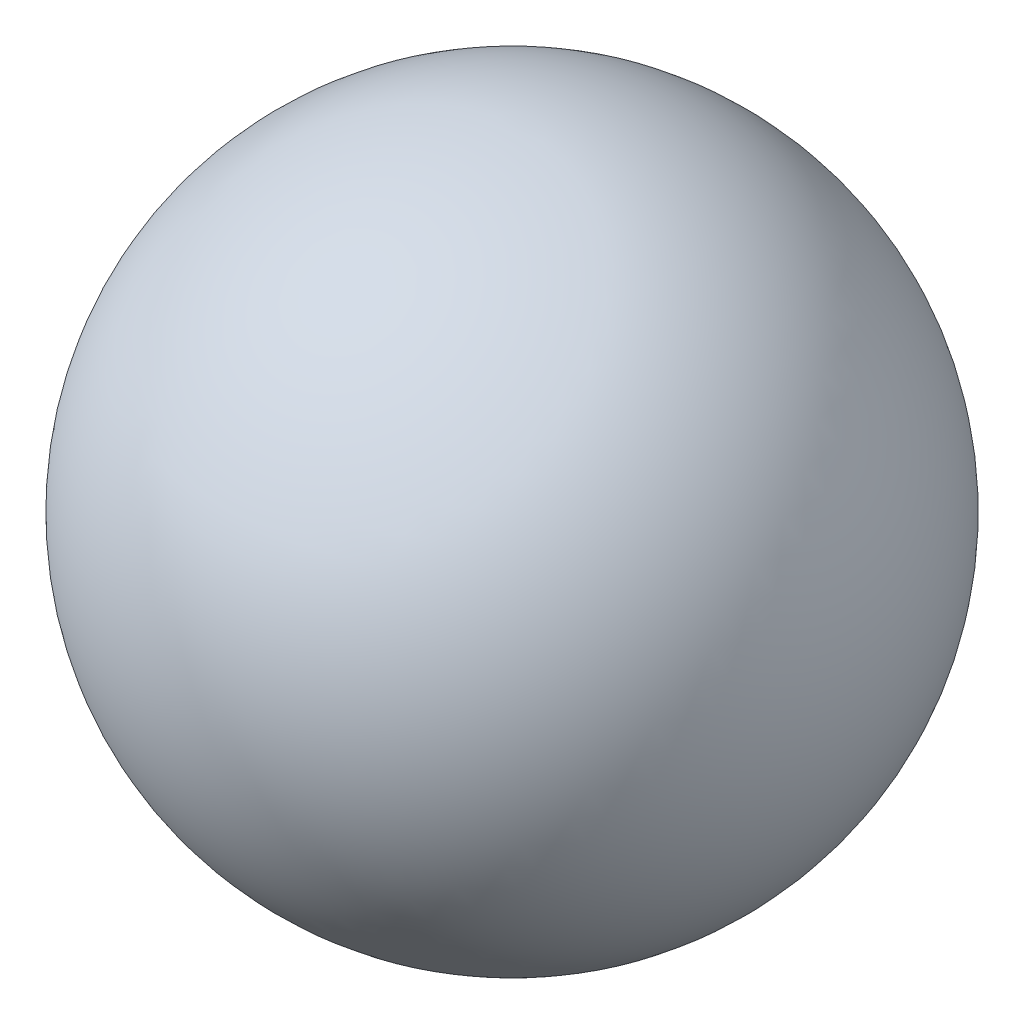
from build123d import *


with BuildPart() as part:
    # Sketch1 → Revolve1 (revolve)
    with BuildSketch(Plane.XY):
        with BuildLine():
            Line((0, 8.5), (0, -8.5))
            ThreePointArc((0, -8.5), (8.5, 0), (0, 8.5))
        make_face()
    revolve(axis=Axis((0, 8.5, 0), (0, -1, 0)))


solid = part.part
